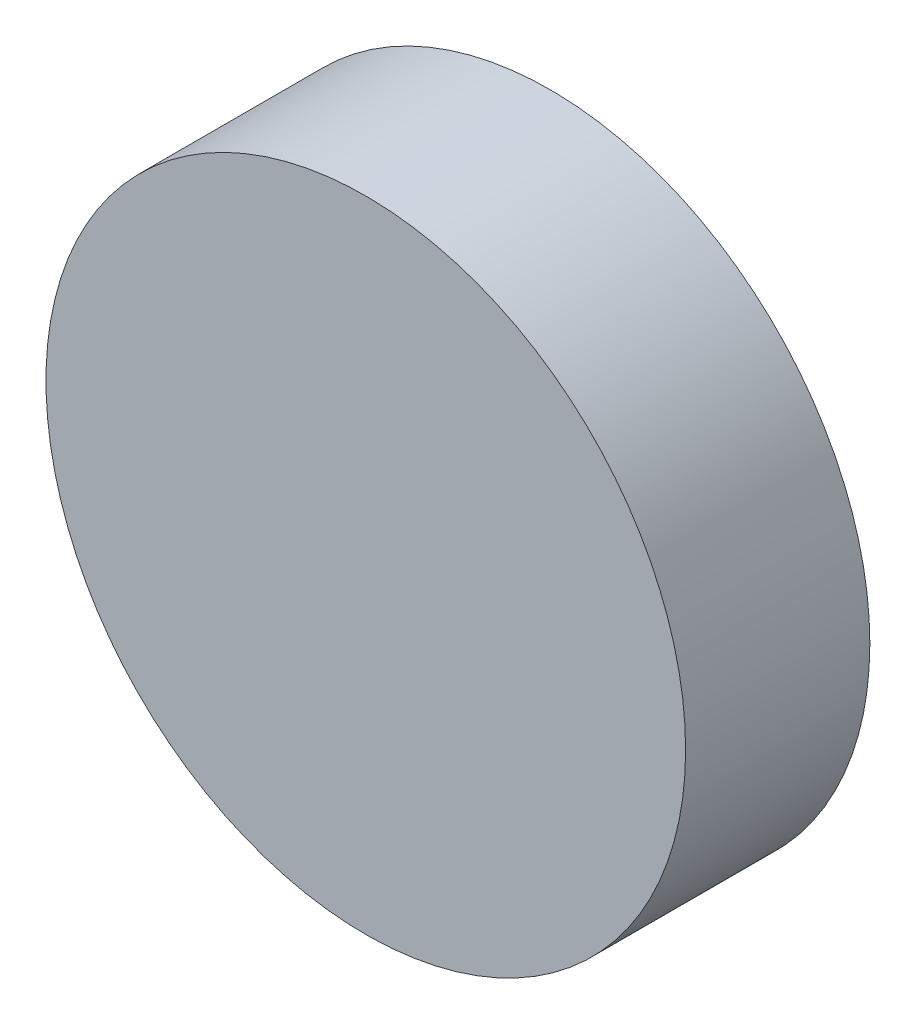
from build123d import *

# Parameters (mm, degrees)
SKETCH1_R           = 7.9375
BOSS_EXTRUDE1_DEPTH = 4.572


with BuildPart() as part:
    # Sketch1 → Boss-Extrude1 (new body)
    with BuildSketch(Plane.XY):
        Circle(SKETCH1_R)
    extrude(amount=BOSS_EXTRUDE1_DEPTH)


solid = part.part
